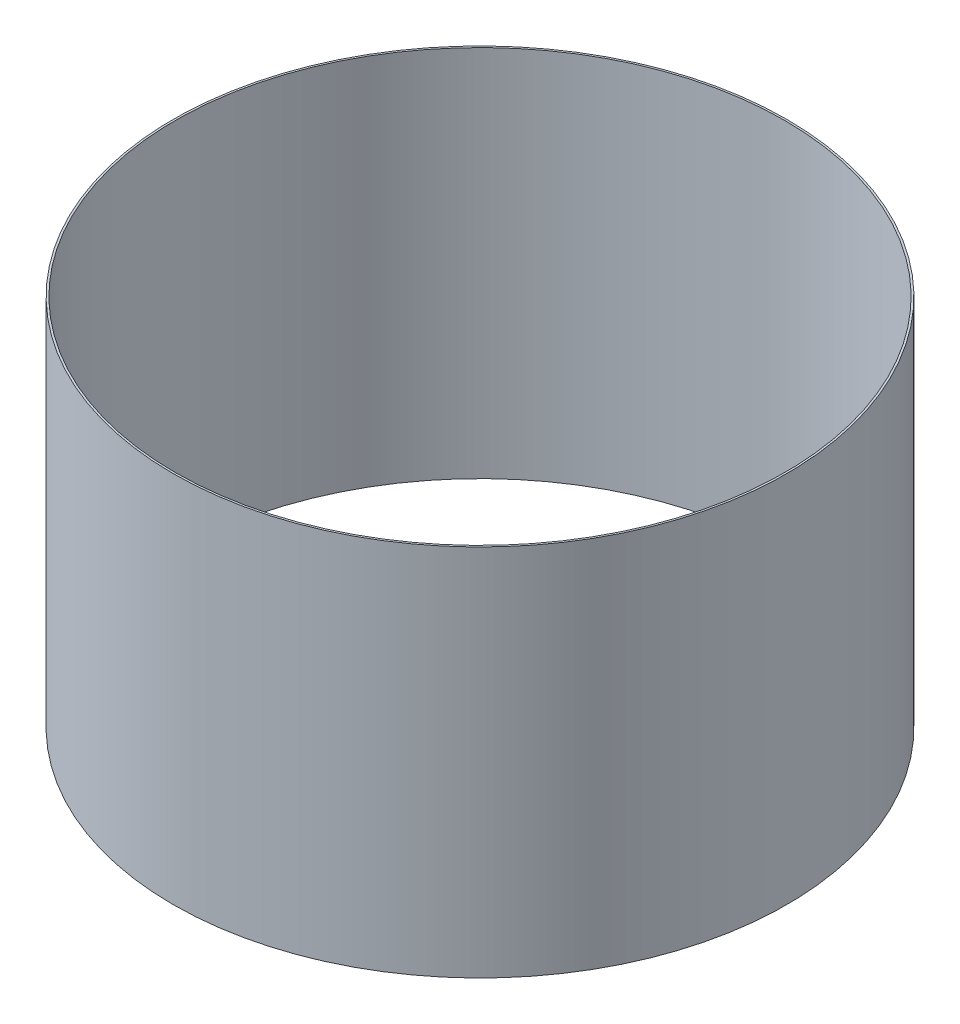
from build123d import *

# Parameters (mm, degrees)
SKETCH1_R           = 125.25375
BOSS_EXTRUDE1_DEPTH = 152.4
SKETCH3_R           = 124.46
CUT_EXTRUDE1_DEPTH  = 234.672342775


with BuildPart() as part:
    # Sketch1 → Boss-Extrude1 (new body)
    with BuildSketch(Plane(origin=(0, 0, 0), x_dir=(1, 0, 0), z_dir=(0, 1, 0))):
        with Locations(Location((0, 0, 0), (0, 0, 90))):
            Circle(SKETCH1_R)
    extrude(amount=BOSS_EXTRUDE1_DEPTH)

    # Sketch3 → Cut-Extrude1 (cut, through all)
    with BuildSketch(Plane.XZ):
        with Locations(Location((0, 0, 0), (0, 0, 270))):
            Circle(SKETCH3_R)
    extrude(amount=-CUT_EXTRUDE1_DEPTH, mode=Mode.SUBTRACT)


solid = part.part
